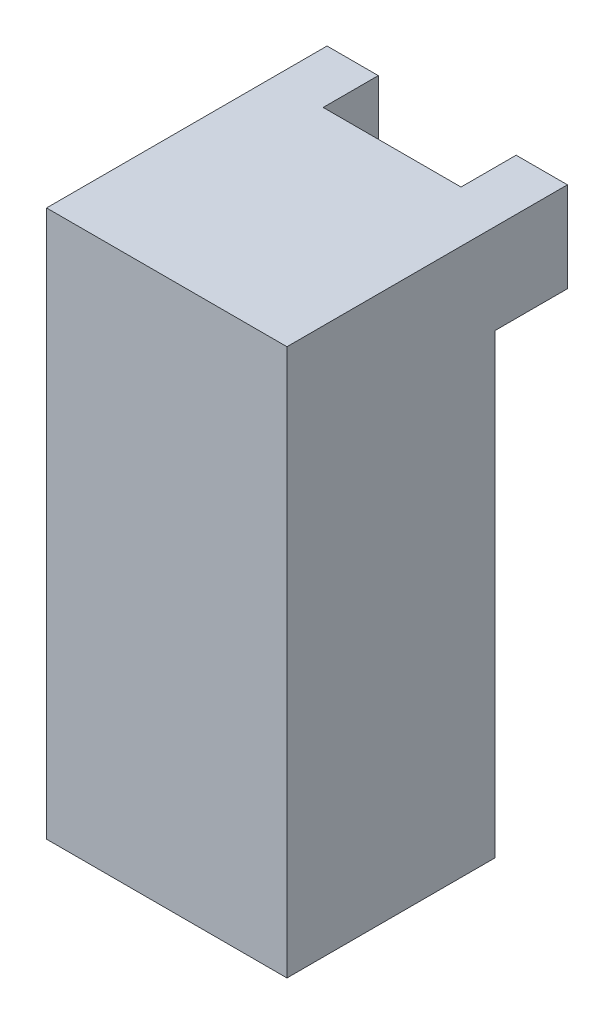
from build123d import *

# Parameters (mm, degrees)
SKETCH1_W           = 5.58
SKETCH1_H           = 4.83
BOSS_EXTRUDE1_DEPTH = 6.345
SKETCH2_W           = 1.19
SKETCH2_H           = 1.68
BOSS_EXTRUDE2_DEPTH = 2.09
SKETCH4_W           = 3.2
SKETCH4_H           = 0.4
BOSS_EXTRUDE3_DEPTH = 2.09


with BuildPart() as part:
    # Sketch1 → Boss-Extrude1 (new, symmetric)
    with BuildSketch(Plane(origin=(0, 0, 0), x_dir=(1, 0, 0), z_dir=(0, 1, 0))):
        Rectangle(SKETCH1_W, SKETCH1_H)
    extrude(amount=BOSS_EXTRUDE1_DEPTH, both=True)

    # Sketch2 → Boss-Extrude2 (add)
    with BuildSketch(Plane(origin=(0, 6.345, 0), x_dir=(1, 0, 0), z_dir=(0, 1, 0))):
        with Locations((-2.195, 3.255)):
            Rectangle(SKETCH2_W, SKETCH2_H)
        with Locations((2.195, 3.255)):
            Rectangle(SKETCH2_W, SKETCH2_H)
    extrude(amount=-BOSS_EXTRUDE2_DEPTH)

    # Sketch4 → Boss-Extrude3 (add)
    with BuildSketch(Plane(origin=(0, 6.345, 0), x_dir=(1, 0, 0), z_dir=(0, 1, 0))):
        with Locations((0, 2.615)):
            Rectangle(SKETCH4_W, SKETCH4_H)
    extrude(amount=-BOSS_EXTRUDE3_DEPTH)


solid = part.part
